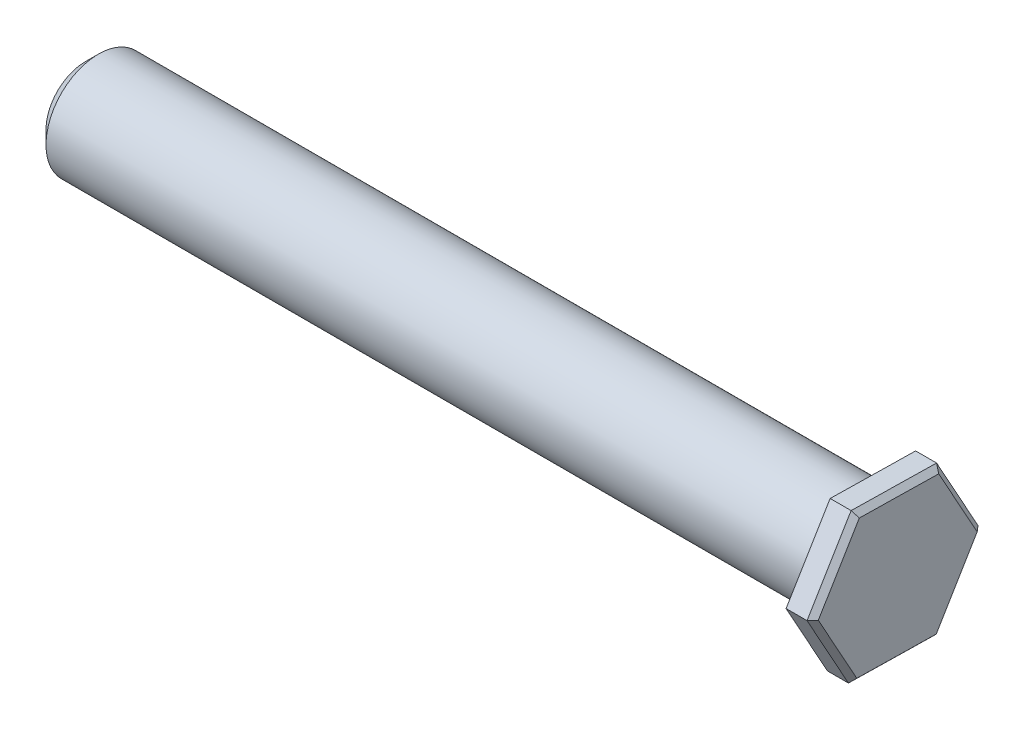
from build123d import *

# Parameters (mm, degrees)
SKETCH1_R           = 10
BOSS_EXTRUDE1_DEPTH = 150
BOSS_EXTRUDE2_DEPTH = 5
CHAMFER1_SIZE       = 1
CHAMFER3_SIZE       = 2.5


with BuildPart() as part:
    # Sketch1 → Boss-Extrude1 (new body)
    with BuildSketch(Plane(origin=(0, 0, 0), x_dir=(0, 0, -1), z_dir=(1, 0, 0))):
        Circle(SKETCH1_R)
    extrude(amount=BOSS_EXTRUDE1_DEPTH)

    # Sketch2 → Boss-Extrude2 (add)
    with BuildSketch(Plane(origin=(150, 0, 0), x_dir=(0, 0, -1), z_dir=(1, 0, 0))):
        Polygon((-16.308454096, 0.29661326), (-8.411101666, -13.975228914), (7.89735243, -14.271842174), (16.308454096, -0.29661326), (8.411101666, 13.975228914), (-7.89735243, 14.271842174), align=None)
    extrude(amount=BOSS_EXTRUDE2_DEPTH)

    # Chamfer1
    chamfer1_edges = [part.edges().sort_by_distance(p)[0] for p in [
        (155, 7.284227717, 12.102903263),
        (155, -6.839307827, 12.359777881),
        (155, -14.123535544, 0.256874618),
        (155, -7.284227717, -12.102903263),
        (155, 6.839307827, -12.359777881),
        (155, 14.123535544, -0.256874618),
    ]]
    chamfer(chamfer1_edges, length=CHAMFER1_SIZE)

    # Chamfer3
    chamfer3_edges = [part.edges().sort_by_distance(p)[0] for p in [
        (0, 0, 10),
    ]]
    chamfer(chamfer3_edges, length=CHAMFER3_SIZE)


solid = part.part
